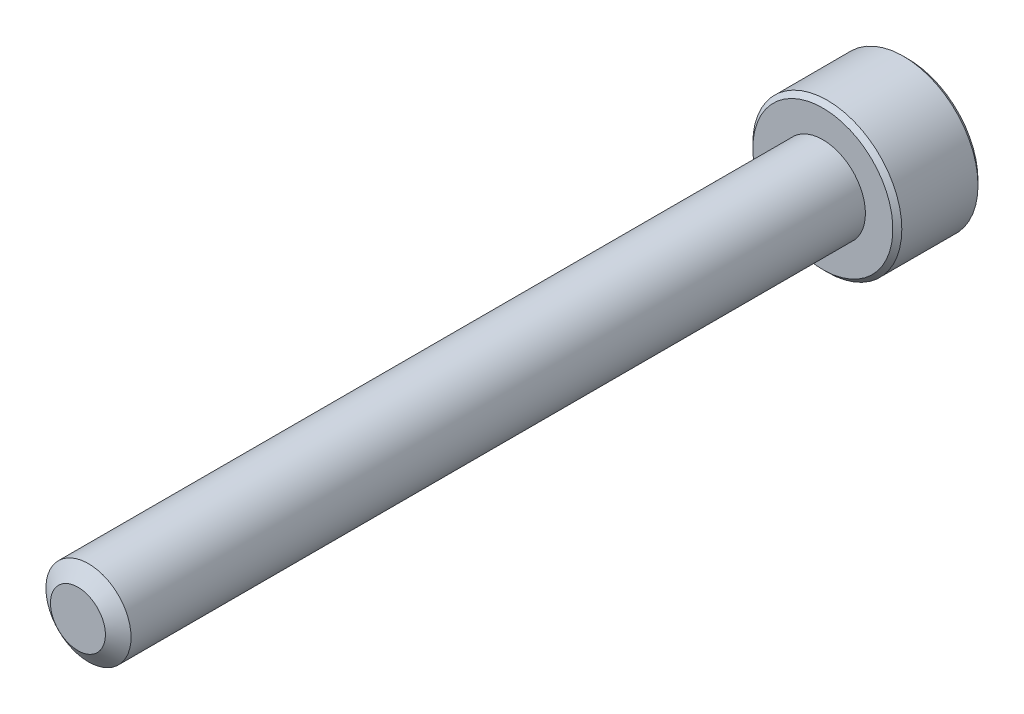
from build123d import *

# Parameters (mm, degrees)
SKETCH1_R          = 2
EXTRUDE1_DEPTH     = 35
SKETCH6_R          = 3.5
EXTRUDE2_DEPTH     = 4
CUT_EXTRUDE1_DEPTH = 2.25
CHAMFER1_SIZE      = 0.21


with BuildPart() as part:
    # Sketch1 → Extrude1 (new body)
    with BuildSketch(Plane.XY):
        Circle(SKETCH1_R)
    extrude(amount=-EXTRUDE1_DEPTH)

    # Sketch4 → Cut-Revolve1 (revolve, cut)
    with BuildSketch(Plane(origin=(0, 0, 0), x_dir=(0, 0, -1), z_dir=(1, 0, 0))):
        Polygon((0.496211411, 2), (0, 1.291336663), (0, 2), align=None)
    revolve(axis=Axis((0, 0, 0), (0, 0, -1)), mode=Mode.SUBTRACT)

    # Sketch6 → Extrude2 (add)
    with BuildSketch(Plane(origin=(0, 0, -35), x_dir=(-1, 0, 0), z_dir=(0, 0, -1))):
        Circle(SKETCH6_R)
    extrude(amount=EXTRUDE2_DEPTH)

    # Sketch7 → Cut-Extrude1 (cut)
    with BuildSketch(Plane(origin=(0, 0, -39), x_dir=(-1, 0, 0), z_dir=(0, 0, -1))):
        Polygon((0, 1.732050808), (-1.5, 0.866025404), (-1.5, -0.866025404), (0, -1.732050808), (1.5, -0.866025404), (1.5, 0.866025404), align=None)
    extrude(amount=-CUT_EXTRUDE1_DEPTH, mode=Mode.SUBTRACT)

    # Cut-Extrude2 cone 1 section (through the dimple's axis) → Cut-Extrude2 (revolve, cut)
    with BuildSketch(Plane(origin=(0, 0, -39), x_dir=(0, 1, 0), z_dir=(1, 0, 0))):
        Polygon((0, 0), (1.732050808, 0), (0, 1.732050808), align=None)
    revolve(axis=Axis((0, 0, -39), (0, 0, 1)), mode=Mode.SUBTRACT)

    # Chamfer1
    chamfer1_edges = [part.edges().sort_by_distance(p)[0] for p in [
        (3.5, 0, -39),
        (3.5, 0, -35),
    ]]
    chamfer(chamfer1_edges, length=CHAMFER1_SIZE)

    # Sketch10 → Revolve1 (revolve)
    with BuildSketch(Plane(origin=(0, 0, 0), x_dir=(0, 0, -1), z_dir=(1, 0, 0))):
        Polygon((35, 2), (35, 0), (33.996572875, 0), (34.825, 2), align=None)
    revolve(axis=Axis((0, 0, -35), (0, 0, 1)))


solid = part.part
